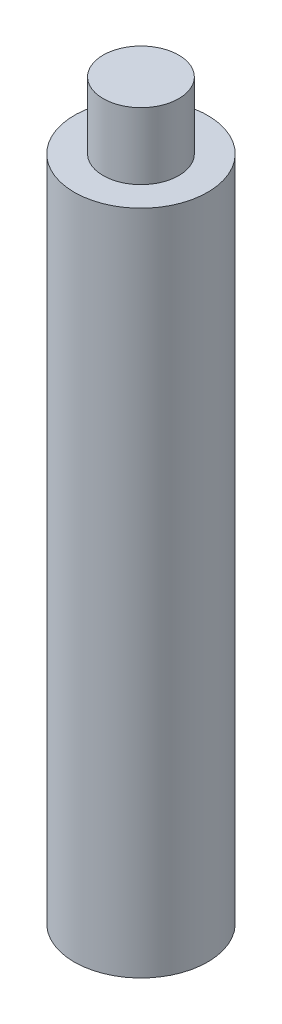
from build123d import *

# Parameters (mm, degrees)
BOSS_EXTRUDE1_START = 3
SKETCH1_R           = 3
SKETCH1_R_2         = 1.7
BOSS_EXTRUDE1_DEPTH = 30
SKETCH2_R           = 1.7
BOSS_EXTRUDE2_DEPTH = 3


with BuildPart() as part:
    # Sketch1 → Boss-Extrude1 (new body)
    with BuildSketch(Plane(origin=(-72.683950256, -103.09859788, -8.697509221), x_dir=(0.9990402772046576, 0, 0.04380096486198651), z_dir=(0, 1, 0)).offset(BOSS_EXTRUDE1_START)):
        with Locations(Location((18.31133747, 0.762110226, 0), (0, 0, 272.510413577))):
            Circle(SKETCH1_R)
        with Locations(Location((18.31133747, 0.762110226, 0), (0, 0, 272.510413577))):
            Circle(SKETCH1_R_2, mode=Mode.SUBTRACT)
    extrude(amount=BOSS_EXTRUDE1_DEPTH)


with BuildPart() as body_2:
    # Sketch2 → Boss-Extrude2 (new body)
    with BuildSketch(Plane(origin=(0, -70.09859788, 0), x_dir=(1, 0, 0), z_dir=(0, 1, 0))):
        with Locations(Location((-54.356805431, 8.656833784, 0), (0, 0, 270))):
            Circle(SKETCH2_R)
    extrude(amount=BOSS_EXTRUDE2_DEPTH)


solid = Compound([part.part, body_2.part])
